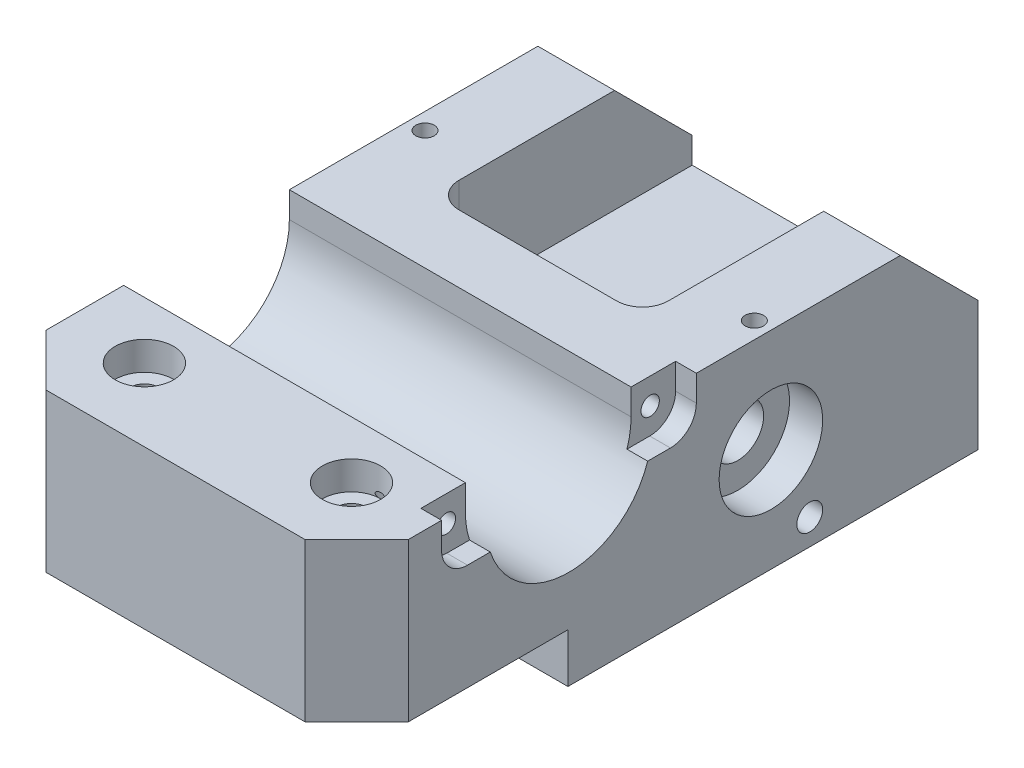
from build123d import *

# Parameters (mm, degrees)
BASE_DEPTH                    = 12.7
BASE_DEPTH_BACK               = 12.7
SKETCH1_W                     = 44.45
SKETCH1_H                     = 76.2
SKETCH2_R                     = 4.7625
SHAFTGUIDE_DEPTH              = 25.4
ACTUATORPLANECUT_DEPTH        = 6.0325
CENTERSLOT_DEPTH              = 46.900442536
CENTERSLOT_DEPTH_BACK         = 46.900442536
SKETCH5_W                     = 25.654
SKETCH5_H                     = 12.7
CENTERSLOTFILLET_R            = 3.175
GEARBOXPIT_DEPTH              = 11.176
SKETCH60_W                    = 25.654
SKETCH60_H                    = 22.225
FRONTCUTAWAY_DEPTH            = 12.7
CHAMFERFRONT_SIZE             = 9.525
GEARBOXSLOTSH_DEPTH           = 2.286
SKETCH55_R                    = 1.5875
GUIDEBARHOLE_DEPTH            = 60.905780189
PITCHSHAFTHOLE_DEPTH          = 46.900442612
PITCHSHAFTHOLE_DEPTH_BACK     = 46.900442612
SKETCH56_R                    = 3.175
SKETCH57_R                    = 6.35
BEARINGBORER_DEPTH            = 4.064
BEARINGBORESETSCREWS_REACH    = 62.778
BEARINGBORESETSCREWS_BORE_R   = 1.1303
TOGGLEASSEMHOLES_D            = 2.7051
TOGGLEASSEMHOLES_DEPTH        = 9.398
TOGGLEASSEMHOLES_TIP          = 0.81269403
BACKCHAMFERS_SIZE             = 6.35
PITCHMOTORSLOT_DEPTH          = 60.905780284
PITCHMOTORMOUNTINGSLOTS_DEPTH = 2.54
PITCHMOTORMOUNTINGHOLES_D     = 2.2606
PITCHMOTORMOUNTINGHOLES_DEPTH = 7.5946
PITCHMOTORMOUNTINGHOLES_TIP   = 0.679152758
GEARBOXMOUNTINGHOLES_D        = 2.7051
GEARBOXMOUNTINGHOLES_DEPTH    = 9.398
GEARBOXMOUNTINGHOLES_TIP      = 0.81269403
CAPMOUNTINGHOLES_D            = 3.6576
CAPMOUNTINGHOLES_CBORE_D      = 7.14502
CAPMOUNTINGHOLES_CBORE_DEPTH  = 3.5052


with BuildPart() as part:
    # Sketch1 → Base (new, two sides: drawn at the far end of the back side and taken through both)
    with BuildSketch(Plane(origin=(0, 0, 0), x_dir=(1, 0, 0), z_dir=(0, 1, 0)).offset(-BASE_DEPTH_BACK)):
        Rectangle(SKETCH1_W, SKETCH1_H)
    extrude(amount=BASE_DEPTH + BASE_DEPTH_BACK)

    # Sketch2 → ShaftGuide (cut)
    with BuildSketch(Plane(origin=(0, 0, -38.1), x_dir=(-1, 0, 0), z_dir=(0, 0, -1))):
        with Locations((0, -12.7)):
            Circle(SKETCH2_R)
    extrude(amount=-SHAFTGUIDE_DEPTH, mode=Mode.SUBTRACT)

    # Sketch3 → ActuatorPlaneCut (cut)
    with BuildSketch(Plane(origin=(0, -12.7, 0), x_dir=(-1, 0, 0), z_dir=(0, -1, 0))):
        Polygon((10.922, -12.192), (16.002, -12.192), (22.225, -12.192), (22.225, -38.1), (-22.225, -38.1), (-22.225, -12.192), (-10.922, -12.192), (-10.922, 4.572), (10.922, 4.572), align=None)
    extrude(amount=-ACTUATORPLANECUT_DEPTH, mode=Mode.SUBTRACT)

    # Sketch5 → CenterSlot (cut, two sides: drawn at the far end of the back side and taken through both)
    with BuildSketch(Plane(origin=(0, 0, 0), x_dir=(1, 0, 0), z_dir=(0, 1, 0)).offset(-CENTERSLOT_DEPTH_BACK)):
        with Locations((0, 12.7)):
            Rectangle(SKETCH5_W, SKETCH5_H)
    extrude(amount=CENTERSLOT_DEPTH + CENTERSLOT_DEPTH_BACK, mode=Mode.SUBTRACT)

    # CenterSlotFillet
    centerslotfillet_edges = [part.edges().sort_by_distance(p)[0] for p in [
        (12.827, 0, -19.05),
        (-12.827, 0, -19.05),
        (-12.827, 0, -6.35),
        (12.827, 0, -6.35),
    ]]
    fillet(centerslotfillet_edges, radius=CENTERSLOTFILLET_R)

    # Sketch40 → GearBoxPit (cut)
    with BuildSketch(Plane.XZ.offset(12.7)):
        with BuildLine():
            Line((10.922, -8.89), (-10.922, -8.89))
            Line((-10.922, -8.89), (-10.922, 9.017))
            ThreePointArc((-10.922, 9.017), (-9.99206403, 11.26206403), (-7.747, 12.192))
            Line((-7.747, 12.192), (7.747, 12.192))
            ThreePointArc((7.747, 12.192), (9.99206403, 11.26206403), (10.922, 9.017))
            Line((10.922, 9.017), (10.922, -8.89))
        make_face()
    extrude(amount=-GEARBOXPIT_DEPTH, mode=Mode.SUBTRACT)

    # Sketch60 → FrontCutaway (cut)
    with BuildSketch(Plane(origin=(0, 12.7, 0), x_dir=(1, 0, 0), z_dir=(0, 1, 0))):
        with Locations((0, 26.9875)):
            Rectangle(SKETCH60_W, SKETCH60_H)
    extrude(amount=-FRONTCUTAWAY_DEPTH, mode=Mode.SUBTRACT)

    # ChamferFront
    chamferfront_edges = [part.edges().sort_by_distance(p)[0] for p in [
        (17.526, 12.7, -38.1),
        (-17.526, 12.7, -38.1),
    ]]
    chamfer(chamferfront_edges, length=CHAMFERFRONT_SIZE)

    # Sketch67 → GearBoxSlotsH (cut)
    with BuildSketch(Plane(origin=(0, -12.7, 0), x_dir=(-1, 0, 0), z_dir=(0, -1, 0))):
        with BuildLine():
            Line((-12.3825, 2.936875), (12.3825, 2.936875))
            ThreePointArc((12.3825, 2.936875), (12.779375, 2.54), (12.3825, 2.143125))
            Line((12.3825, 2.143125), (-12.3825, 2.143125))
            ThreePointArc((-12.3825, 2.143125), (-12.779375, 2.54), (-12.3825, 2.936875))
        make_face()
        with BuildLine():
            Line((-12.3825, -7.731125), (12.3825, -7.731125))
            ThreePointArc((12.3825, -7.731125), (12.779375, -8.128), (12.3825, -8.524875))
            Line((12.3825, -8.524875), (-12.3825, -8.524875))
            ThreePointArc((-12.3825, -8.524875), (-12.779375, -8.128), (-12.3825, -7.731125))
        make_face()
    extrude(amount=-GEARBOXSLOTSH_DEPTH, mode=Mode.SUBTRACT)

    # Sketch55 → GuideBarHole (cut, through all)
    with BuildSketch(Plane.ZY.offset(22.225)):
        with Locations((-17.4625, -9.525)):
            Circle(SKETCH55_R)
    extrude(amount=-GUIDEBARHOLE_DEPTH, mode=Mode.SUBTRACT)

    # Sketch56 → PitchShaftHole (cut, two sides: drawn at the far end of the back side and taken through both)
    with BuildSketch(Plane(origin=(0, 0, 0), x_dir=(0, 0, -1), z_dir=(1, 0, 0)).offset(-PITCHSHAFTHOLE_DEPTH_BACK)):
        with Locations((12.7, 0)):
            Circle(SKETCH56_R)
    extrude(amount=PITCHSHAFTHOLE_DEPTH + PITCHSHAFTHOLE_DEPTH_BACK, mode=Mode.SUBTRACT)

    # Sketch57 → BearingBoreR (cut)
    with BuildSketch(Plane.ZY.offset(22.225)):
        with Locations((-12.7, 0)):
            Circle(SKETCH57_R)
    bearingborer = extrude(amount=-BEARINGBORER_DEPTH, mode=Mode.SUBTRACT)

    # BearingBoreL: BearingBoreR across plane
    add(bearingborer.mirror(Plane(origin=(0, 0, 0), x_dir=(0, 0, 1), z_dir=(1, 0, 0))), mode=Mode.SUBTRACT)

    # BearingBoreSetScrews bore → BearingBoreSetScrews (cut, up to next)
    with BuildSketch(Plane(origin=(4.343261145, 12.7, -10.30436568), x_dir=(1, 0, 0), z_dir=(0, 1, 0)), mode=Mode.PRIVATE) as bearingboresetscrews_sk1:
        with Locations((-24.536261145, 2.39563432)):
            Circle(BEARINGBORESETSCREWS_BORE_R)
    bearingboresetscrews_tool1 = extrude(bearingboresetscrews_sk1.sketch, amount=-BEARINGBORESETSCREWS_REACH, mode=Mode.PRIVATE) & part.part
    # BearingBoreSetScrews bore → BearingBoreSetScrews (cut, up to next)
    with BuildSketch(Plane(origin=(4.343261145, 12.7, -10.30436568), x_dir=(1, 0, 0), z_dir=(0, 1, 0)), mode=Mode.PRIVATE) as bearingboresetscrews_sk2:
        with Locations((15.849738855, 2.39563432)):
            Circle(BEARINGBORESETSCREWS_BORE_R)
    bearingboresetscrews_tool2 = extrude(bearingboresetscrews_sk2.sketch, amount=-BEARINGBORESETSCREWS_REACH, mode=Mode.PRIVATE) & part.part
    add(bearingboresetscrews_tool1.solids().sort_by_distance((-20.193, 12.7, -12.7))[0], mode=Mode.SUBTRACT)
    add(bearingboresetscrews_tool2.solids().sort_by_distance((20.193, 12.7, -12.7))[0], mode=Mode.SUBTRACT)

    # ToggleAssemHoles
    with Locations(Plane(origin=(0, -12.7, 0), x_dir=(-1, 0, 0), z_dir=(0, -1, 0))):
        with Locations((12.7, 31.75), (-12.7, 31.75)):
            Hole(TOGGLEASSEMHOLES_D / 2, depth=TOGGLEASSEMHOLES_DEPTH)
            with Locations((0, 0, -(TOGGLEASSEMHOLES_DEPTH + TOGGLEASSEMHOLES_TIP / 2))):  # 118° drill point
                Cone(0, TOGGLEASSEMHOLES_D / 2, TOGGLEASSEMHOLES_TIP, mode=Mode.SUBTRACT)

    # BackChamfers
    backchamfers_edges = [part.edges().sort_by_distance(p)[0] for p in [
        (-22.225, 3.01625, 38.1),
        (22.225, 3.01625, 38.1),
    ]]
    chamfer(backchamfers_edges, length=BACKCHAMFERS_SIZE)

    # Sketch62 → PitchMotorSlot (cut, through all)
    with BuildSketch(Plane.ZY.offset(22.225)):
        with BuildLine():
            Line((1.905, 9.525), (1.905, 12.7))
            Line((1.905, 12.7), (22.225, 12.7))
            Line((22.225, 12.7), (22.225, 9.525))
            ThreePointArc((22.225, 9.525), (12.065, -0.635), (1.905, 9.525))
        make_face()
    extrude(amount=-PITCHMOTORSLOT_DEPTH, mode=Mode.SUBTRACT)

    # Sketch63 → PitchMotorMountingSlots (cut)
    with BuildSketch(Plane.ZY.offset(-22.225)):
        with BuildLine():
            Line((-3.556, 12.7), (27.686, 12.7))
            Line((27.686, 12.7), (27.686, 9.525))
            ThreePointArc((27.686, 9.525), (26.75606403, 7.27993597), (24.511, 6.35))
            Line((24.511, 6.35), (-0.381, 6.35))
            ThreePointArc((-0.381, 6.35), (-2.62606403, 7.27993597), (-3.556, 9.525))
            Line((-3.556, 9.525), (-3.556, 12.7))
        make_face()
    extrude(amount=PITCHMOTORMOUNTINGSLOTS_DEPTH, mode=Mode.SUBTRACT)

    # PitchMotorMountingHoles
    with Locations(Plane(origin=(19.685, 0, 0), x_dir=(0, 0, -1), z_dir=(1, 0, 0))):
        with Locations((-24.5618, 9.525), (0.4318, 9.525)):
            Hole(PITCHMOTORMOUNTINGHOLES_D / 2, depth=PITCHMOTORMOUNTINGHOLES_DEPTH)
            with Locations((0, 0, -(PITCHMOTORMOUNTINGHOLES_DEPTH + PITCHMOTORMOUNTINGHOLES_TIP / 2))):  # 118° drill point
                Cone(0, PITCHMOTORMOUNTINGHOLES_D / 2, PITCHMOTORMOUNTINGHOLES_TIP, mode=Mode.SUBTRACT)

    # GearBoxMountingHoles
    with Locations(Plane(origin=(0, -12.7, 0), x_dir=(-1, 0, 0), z_dir=(0, -1, 0))):
        with Locations((-14.732, -2.794), (14.732, -2.794)):
            Hole(GEARBOXMOUNTINGHOLES_D / 2, depth=GEARBOXMOUNTINGHOLES_DEPTH)
            with Locations((0, 0, -(GEARBOXMOUNTINGHOLES_DEPTH + GEARBOXMOUNTINGHOLES_TIP / 2))):  # 118° drill point
                Cone(0, GEARBOXMOUNTINGHOLES_D / 2, GEARBOXMOUNTINGHOLES_TIP, mode=Mode.SUBTRACT)

    # CapMountingHoles (through all)
    with Locations(Plane(origin=(-0.837932951, 12.7, 8.633720573), x_dir=(-1, 0, 0), z_dir=(0, 1, 0))):
        with Locations((-13.537932951, 20.576279427), (11.862067049, 20.576279427)):
            CounterBoreHole(CAPMOUNTINGHOLES_D / 2, CAPMOUNTINGHOLES_CBORE_D / 2, CAPMOUNTINGHOLES_CBORE_DEPTH)


solid = part.part
